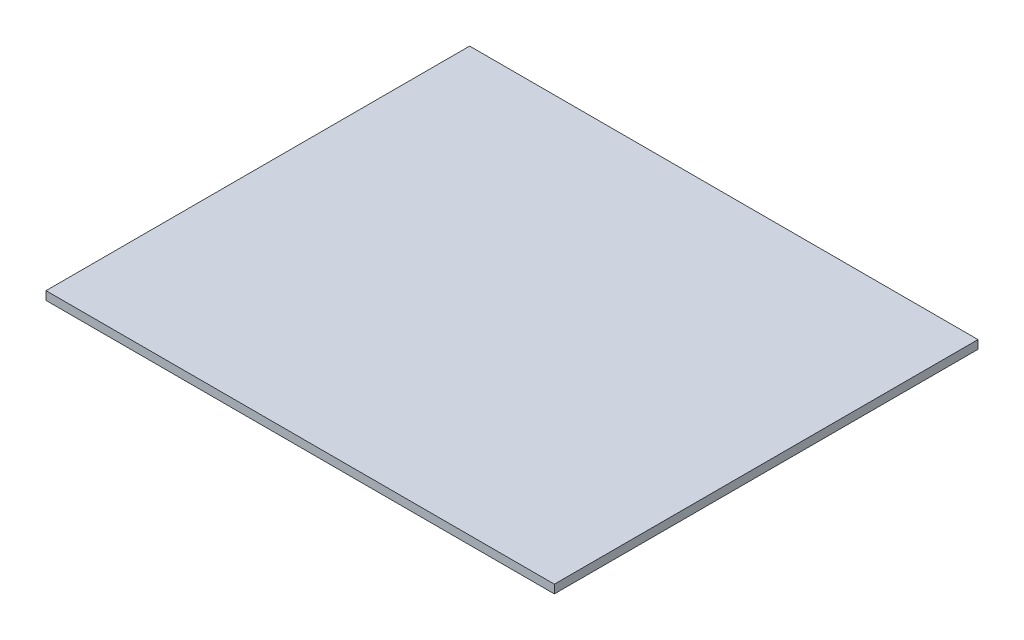
from build123d import *

# Parameters (mm, degrees)
SKETCH1_W           = 600
SKETCH1_H           = 500
BOSS_EXTRUDE1_DEPTH = 10


with BuildPart() as part:
    # Sketch1 → Boss-Extrude1 (new body)
    with BuildSketch(Plane(origin=(0, 0, 0), x_dir=(1, 0, 0), z_dir=(0, 1, 0))):
        Rectangle(SKETCH1_W, SKETCH1_H)
    extrude(amount=BOSS_EXTRUDE1_DEPTH)


solid = part.part
